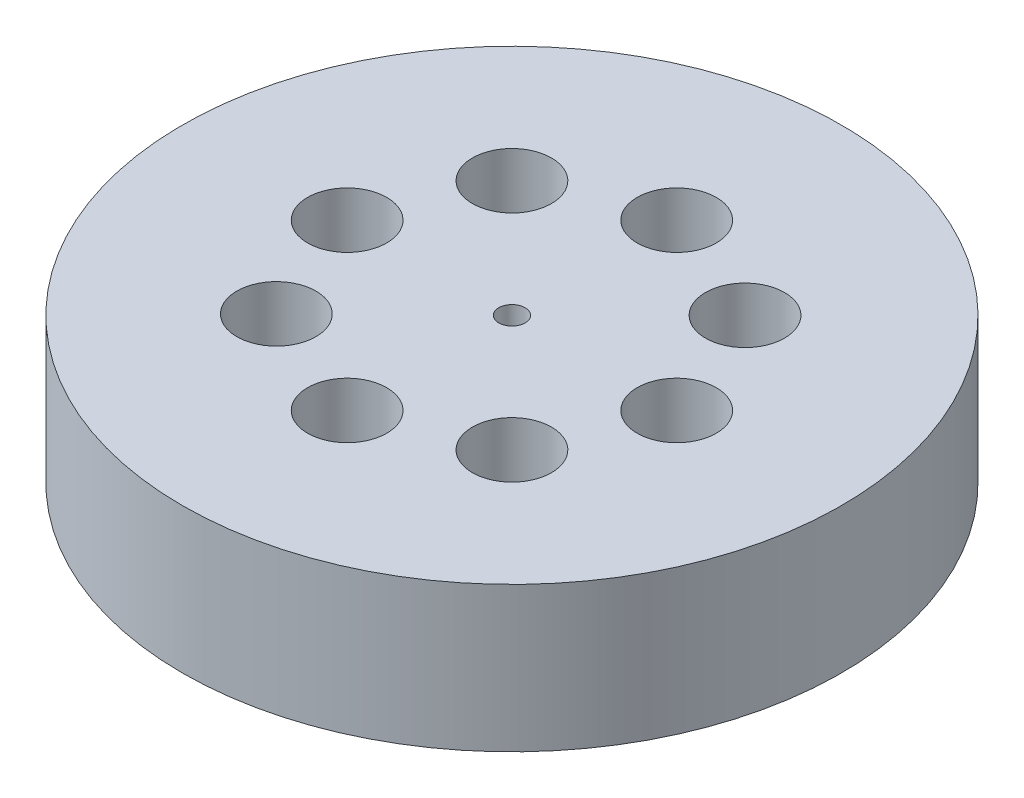
from build123d import *

# Parameters (mm, degrees)
ESQUISSE1_R              = 50
BOSS_EXTRU_1_DEPTH       = 22
ESQUISSE5_R              = 6
ENL_V_MAT_EXTRU_6_DEPTH  = 22
ESQUISSE7_R              = 6
ENL_V_MAT_EXTRU_7_DEPTH  = 22
ESQUISSE8_R              = 6
ENL_V_MAT_EXTRU_8_DEPTH  = 22
ESQUISSE9_R              = 6
ENL_V_MAT_EXTRU_9_DEPTH  = 22
ESQUISSE10_R             = 6
ENL_V_MAT_EXTRU_10_DEPTH = 22
ESQUISSE11_R             = 6
ENL_V_MAT_EXTRU_11_DEPTH = 22
ESQUISSE12_R             = 6
ENL_V_MAT_EXTRU_12_DEPTH = 22
ESQUISSE13_R             = 6
ENL_V_MAT_EXTRU_13_DEPTH = 22
ESQUISSE14_R             = 10
ENL_V_MAT_EXTRU_15_DEPTH = 18
ESQUISSE15_R             = 2
ENL_V_MAT_EXTRU_16_DEPTH = 4


with BuildPart() as part:
    # Esquisse1 → Boss.-Extru.1 (new body)
    with BuildSketch(Plane(origin=(0, 0, 0), x_dir=(1, 0, 0), z_dir=(0, 1, 0))):
        with Locations(Location((0, 0, 0), (0, 0, 270))):
            Circle(ESQUISSE1_R)
    extrude(amount=BOSS_EXTRU_1_DEPTH)

    # Esquisse5 → Enlèv. mat.-Extru.6 (cut)
    with BuildSketch(Plane(origin=(0, 0, 0), x_dir=(-1, 0, 0), z_dir=(0, -1, 0))):
        with Locations(Location((-17.68, 17.68, 0), (0, 0, 90))):
            Circle(ESQUISSE5_R)
    extrude(amount=-ENL_V_MAT_EXTRU_6_DEPTH, mode=Mode.SUBTRACT)

    # Esquisse7 → Enlèv. mat.-Extru.7 (cut)
    with BuildSketch(Plane(origin=(0, 0, 0), x_dir=(-1, 0, 0), z_dir=(0, -1, 0))):
        with Locations(Location((18.058126749, -17.68, 0), (0, 0, 90))):
            Circle(ESQUISSE7_R)
    extrude(amount=-ENL_V_MAT_EXTRU_7_DEPTH, mode=Mode.SUBTRACT)

    # Esquisse8 → Enlèv. mat.-Extru.8 (cut)
    with BuildSketch(Plane(origin=(0, 0, 0), x_dir=(-1, 0, 0), z_dir=(0, -1, 0))):
        with Locations(Location((17.68, 17.68, 0), (0, 0, 90))):
            Circle(ESQUISSE8_R)
    extrude(amount=-ENL_V_MAT_EXTRU_8_DEPTH, mode=Mode.SUBTRACT)

    # Esquisse9 → Enlèv. mat.-Extru.9 (cut)
    with BuildSketch(Plane(origin=(0, 0, 0), x_dir=(-1, 0, 0), z_dir=(0, -1, 0))):
        with Locations(Location((-17.68, -17.68, 0), (0, 0, 90))):
            Circle(ESQUISSE9_R)
    extrude(amount=-ENL_V_MAT_EXTRU_9_DEPTH, mode=Mode.SUBTRACT)

    # Esquisse10 → Enlèv. mat.-Extru.10 (cut)
    with BuildSketch(Plane.XZ):
        with Locations(Location((0, 25, 0), (0, 0, 270))):
            Circle(ESQUISSE10_R)
    extrude(amount=-ENL_V_MAT_EXTRU_10_DEPTH, mode=Mode.SUBTRACT)

    # Esquisse11 → Enlèv. mat.-Extru.11 (cut)
    with BuildSketch(Plane(origin=(0, 0, 0), x_dir=(-1, 0, 0), z_dir=(0, -1, 0))):
        with Locations(Location((25, 0, 0), (0, 0, 90))):
            Circle(ESQUISSE11_R)
    extrude(amount=-ENL_V_MAT_EXTRU_11_DEPTH, mode=Mode.SUBTRACT)

    # Esquisse12 → Enlèv. mat.-Extru.12 (cut)
    with BuildSketch(Plane(origin=(0, 0, 0), x_dir=(-1, 0, 0), z_dir=(0, -1, 0))):
        with Locations(Location((-25, 0, 0), (0, 0, 90))):
            Circle(ESQUISSE12_R)
    extrude(amount=-ENL_V_MAT_EXTRU_12_DEPTH, mode=Mode.SUBTRACT)

    # Esquisse13 → Enlèv. mat.-Extru.13 (cut)
    with BuildSketch(Plane(origin=(0, 0, 0), x_dir=(-1, 0, 0), z_dir=(0, -1, 0))):
        with Locations(Location((0, 25, 0), (0, 0, 90))):
            Circle(ESQUISSE13_R)
    extrude(amount=-ENL_V_MAT_EXTRU_13_DEPTH, mode=Mode.SUBTRACT)

    # Esquisse14 → Enlèv. mat.-Extru.15 (cut)
    with BuildSketch(Plane(origin=(0, 0, 0), x_dir=(-1, 0, 0), z_dir=(0, -1, 0))):
        with Locations(Location((0, 0, 0), (0, 0, 90))):
            Circle(ESQUISSE14_R)
    extrude(amount=-ENL_V_MAT_EXTRU_15_DEPTH, mode=Mode.SUBTRACT)

    # Esquisse15 → Enlèv. mat.-Extru.16 (cut)
    with BuildSketch(Plane(origin=(0, 18, 0), x_dir=(-1, 0, 0), z_dir=(0, -1, 0))):
        with Locations(Location((0, 0, 0), (0, 0, 90))):
            Circle(ESQUISSE15_R)
    extrude(amount=-ENL_V_MAT_EXTRU_16_DEPTH, mode=Mode.SUBTRACT)


solid = part.part
